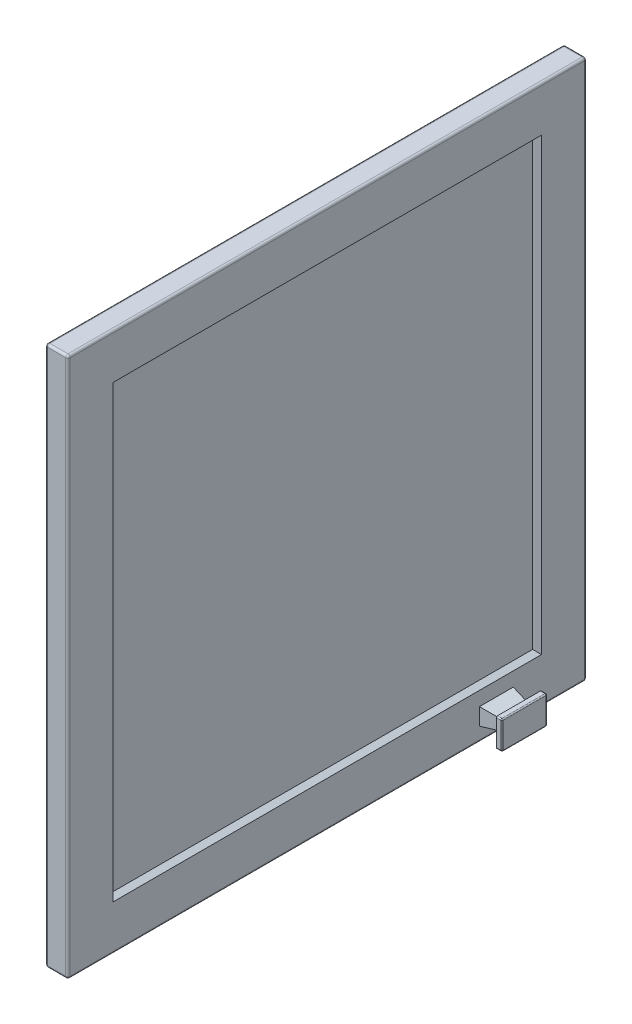
from build123d import *

# Parameters (mm, degrees)
SKETCH1_W               = 479
SKETCH1_H               = 460
BOSS_EXTRUDE1_DEPTH     = 10
SKETCH2_W               = 399
SKETCH2_H               = 380
CUT_EXTRUDE1_DEPTH      = 5
CUT_EXTRUDE1_DRAFT      = -30
MIRROR1_COPY_1_SKETCH_W = 399
MIRROR1_COPY_1_SKETCH_H = 380
MIRROR1_COPY_1_DEPTH    = 5
MIRROR1_COPY_1_DRAFT    = -30
SKETCH3_W               = 15
SKETCH3_H               = 30
BOSS_EXTRUDE2_DEPTH     = 20
BOSS_EXTRUDE2_TAPER     = 10
SKETCH4_W               = 25
SKETCH4_H               = 40
BOSS_EXTRUDE3_DEPTH     = 5
FILLET3_R               = 2
FILLET4_R               = 1


with BuildPart() as part:
    # Sketch1 → Boss-Extrude1 (new, symmetric)
    with BuildSketch(Plane.YZ):
        with Locations((239.5, 230)):
            Rectangle(SKETCH1_W, SKETCH1_H)
    extrude(amount=BOSS_EXTRUDE1_DEPTH, both=True)


with BuildPart() as cut_extrude1_tool:
    # Sketch2 → Cut-Extrude1 (with draft: the straight prism first)
    with BuildSketch(Plane.YZ.offset(10)):
        with Locations((239.5, 230)):
            Rectangle(SKETCH2_W, SKETCH2_H)
    extrude(amount=-CUT_EXTRUDE1_DEPTH)
    # Cut-Extrude1: the draft: its side faces are tilted about the plane it starts from
    cut_extrude1_sides = [cut_extrude1_tool.faces().sort_by_distance(p)[0] for p in [
        (7.5, 40, 230),
        (7.5, 239.5, 40),
        (7.5, 439, 230),
        (7.5, 239.5, 420),
    ]]
    draft(cut_extrude1_sides, Plane.YZ.offset(10), CUT_EXTRUDE1_DRAFT)


with BuildPart() as part_1:
    add(part.part)

    # Cut-Extrude1: cut by cut_extrude1_tool
    add(cut_extrude1_tool.part, mode=Mode.SUBTRACT)


with BuildPart() as mirror1_copy_1_tool:
    # Mirror1 copy 1 sketch → Mirror1 copy 1 (with draft: the straight prism first)
    with BuildSketch(Plane(origin=(-10, 0, 0), x_dir=(0, 1, 0), z_dir=(-1, 0, 0))):
        with Locations((239.5, -230)):
            Rectangle(MIRROR1_COPY_1_SKETCH_W, MIRROR1_COPY_1_SKETCH_H)
    extrude(amount=-MIRROR1_COPY_1_DEPTH)
    # Mirror1 copy 1: the draft: its side faces are tilted about the plane it starts from
    mirror1_copy_1_sides = [mirror1_copy_1_tool.faces().sort_by_distance(p)[0] for p in [
        (-7.5, 40, 230),
        (-7.5, 239.5, 40),
        (-7.5, 439, 230),
        (-7.5, 239.5, 420),
    ]]
    draft(mirror1_copy_1_sides, Plane(origin=(-10, 0, 0), x_dir=(0, 1, 0), z_dir=(-1, 0, 0)), MIRROR1_COPY_1_DRAFT)


with BuildPart() as part_2:
    add(part_1.part)

    # Mirror1 copy 1: cut by mirror1_copy_1_tool
    add(mirror1_copy_1_tool.part, mode=Mode.SUBTRACT)

    # Sketch3 → Boss-Extrude2 (add)
    with BuildSketch(Plane.YZ.offset(10)):
        with Locations((459, 80)):
            Rectangle(SKETCH3_W, SKETCH3_H)
    extrude(amount=BOSS_EXTRUDE2_DEPTH, taper=BOSS_EXTRUDE2_TAPER)

    # Sketch4 → Boss-Extrude3 (add)
    with BuildSketch(Plane.YZ.offset(30)):
        with Locations((459, 80)):
            Rectangle(SKETCH4_W, SKETCH4_H)
    extrude(amount=BOSS_EXTRUDE3_DEPTH)

    # Fillet3
    fillet3_edges = [part_2.edges().sort_by_distance(p)[0] for p in [
        (10, 479, 230),
        (10, 239.5, 460),
        (10, 0, 230),
        (-10, 239.5, 460),
        (-10, 479, 230),
        (-10, 239.5, 0),
        (-10, 0, 230),
        (0, 0, 460),
        (0, 479, 460),
        (0, 479, 0),
        (0, 0, 0),
        (10, 239.5, 0),
    ]]
    fillet(fillet3_edges, radius=FILLET3_R)

    # Fillet4
    fillet4_edges = [part_2.edges().sort_by_distance(p)[0] for p in [
        (32.5, 446.5, 100),
        (32.5, 446.5, 60),
        (32.5, 471.5, 60),
        (32.5, 471.5, 100),
        (35, 446.5, 80),
        (35, 459, 60),
        (35, 471.5, 80),
        (35, 459, 100),
    ]]
    fillet(fillet4_edges, radius=FILLET4_R)


with BuildPart() as body_2:
    # Mirror2: mirrored copy
    add(part_2.part.mirror(Plane.ZX))


solid = body_2.part
